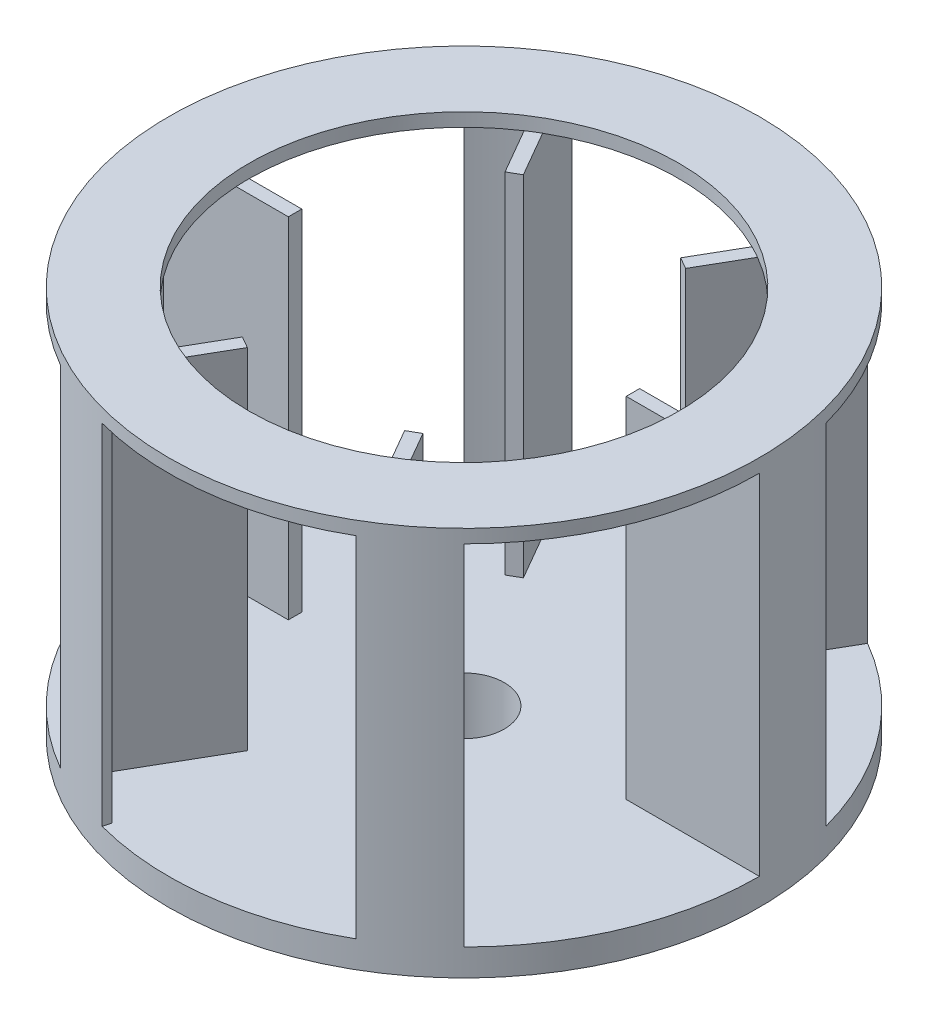
from build123d import *
from build123d.topology import SkipClean

# Parameters (mm, degrees)
SKETCH1_R                      = 137.5
BOSS_EXTRUDE1_DEPTH            = 6.25
BOSS_EXTRUDE2_START            = 162.5
BOSS_EXTRUDE2_DEPTH            = 162.5
BOSS_EXTRUDE3_START            = 12.5
SKETCH3_R                      = 137.5
BOSS_EXTRUDE3_DEPTH            = 12.5
SKETCH4_R                      = 37.5
BOSS_EXTRUDE4_DEPTH            = 62.5
CUT_EXTRUDE1_REACH             = 313.812
SKETCH5_R                      = 18.75
CUT_EXTRUDE1_DIRECTION_2_DEPTH = 312.811742082
SKETCH6_R                      = 100
CUT_EXTRUDE2_DEPTH             = 6.25


with BuildPart() as part:
    # Sketch1 → Boss-Extrude1 (new body)
    with BuildSketch(Plane(origin=(0, 0, 0), x_dir=(1, 0, 0), z_dir=(0, 1, 0))):
        with Locations(Location((0, 0, 0), (0, 0, 270))):
            Circle(SKETCH1_R)
    extrude(amount=BOSS_EXTRUDE1_DEPTH)

    # Sketch2 → Boss-Extrude2 (add)
    with SkipClean():  # the faces are left unmerged after this step: merging them gives an invalid solid
        with BuildSketch(Plane.XZ.offset(BOSS_EXTRUDE2_START)):
            with BuildLine():
                Line((137.5, 0), (75.5, 0))
                Line((75.5, 0), (75.5, -6.25))
                Line((75.5, -6.25), (133.603892159, -6.25))
                ThreePointArc((133.603892159, -6.25), (132.161525003, -20.552221504), (129.192579266, -34.617047282))
                Line((129.192579266, -34.617047282), (132.814801115, -35.587618702))
                ThreePointArc((132.814801115, -35.587618702), (136.323668439, -17.94735143), (137.5, 0))
            make_face()
            with BuildLine():
                Line((68.75, -119.07849302), (37.75, -65.384917986))
                Line((37.75, -65.384917986), (32.337341226, -68.509917986))
                Line((32.337341226, -68.509917986), (61.389287306, -118.829364654))
                ThreePointArc((61.389287306, -118.829364654), (48.282016575, -124.731348808), (34.617047282, -129.192579266))
                Line((34.617047282, -129.192579266), (35.587618702, -132.814801115))
                ThreePointArc((35.587618702, -132.814801115), (52.61897195, -127.03343572), (68.75, -119.07849302))
            make_face()
            with BuildLine():
                Line((-68.75, -119.07849302), (-37.75, -65.384917986))
                Line((-37.75, -65.384917986), (-43.162658774, -62.259917986))
                Line((-43.162658774, -62.259917986), (-72.214604853, -112.579364654))
                ThreePointArc((-72.214604853, -112.579364654), (-83.879508429, -104.179127304), (-94.575531984, -94.575531984))
                Line((-94.575531984, -94.575531984), (-97.227182413, -97.227182413))
                ThreePointArc((-97.227182413, -97.227182413), (-83.704696489, -109.08608429), (-68.75, -119.07849302))
            make_face()
            with BuildLine():
                Line((-137.5, 0), (-75.5, 0))
                Line((-75.5, 0), (-75.5, 6.25))
                Line((-75.5, 6.25), (-133.603892159, 6.25))
                ThreePointArc((-133.603892159, 6.25), (-132.161525003, 20.552221504), (-129.192579266, 34.617047282))
                Line((-129.192579266, 34.617047282), (-132.814801115, 35.587618702))
                ThreePointArc((-132.814801115, 35.587618702), (-136.323668439, 17.94735143), (-137.5, 0))
            make_face()
            with BuildLine():
                Line((-68.75, 119.07849302), (-37.75, 65.384917986))
                Line((-37.75, 65.384917986), (-32.337341226, 68.509917986))
                Line((-32.337341226, 68.509917986), (-61.389287306, 118.829364654))
                ThreePointArc((-61.389287306, 118.829364654), (-48.282016575, 124.731348808), (-34.617047282, 129.192579266))
                Line((-34.617047282, 129.192579266), (-35.587618702, 132.814801115))
                ThreePointArc((-35.587618702, 132.814801115), (-52.61897195, 127.03343572), (-68.75, 119.07849302))
            make_face()
            with BuildLine():
                Line((68.75, 119.07849302), (37.75, 65.384917986))
                Line((37.75, 65.384917986), (43.162658774, 62.259917986))
                Line((43.162658774, 62.259917986), (72.214604853, 112.579364654))
                ThreePointArc((72.214604853, 112.579364654), (83.879508429, 104.179127304), (94.575531984, 94.575531984))
                Line((94.575531984, 94.575531984), (97.227182413, 97.227182413))
                ThreePointArc((97.227182413, 97.227182413), (83.704696489, 109.08608429), (68.75, 119.07849302))
            make_face()
        extrude(amount=-BOSS_EXTRUDE2_DEPTH)

    # Sketch3 → Boss-Extrude3 (add)
    with BuildSketch(Plane.XZ.offset(162.5).offset(BOSS_EXTRUDE3_START)):
        with Locations(Location((0, 0, 0), (0, 0, 270))):
            Circle(SKETCH3_R)
    extrude(amount=-BOSS_EXTRUDE3_DEPTH)

    # Sketch4 → Boss-Extrude4 (add)
    with BuildSketch(Plane.XZ.offset(175)):
        with Locations(Location((0, 0, 0), (0, 0, 270))):
            Circle(SKETCH4_R)
    extrude(amount=BOSS_EXTRUDE4_DEPTH)

    # Sketch5 → Cut-Extrude1 (cut, up to next)
    with BuildSketch(Plane.XZ.offset(237.5), mode=Mode.PRIVATE) as cut_extrude1_sk1:
        with Locations(Location((0, 0, 0), (0, 0, 90))):
            Circle(SKETCH5_R)
    cut_extrude1_tool1 = extrude(cut_extrude1_sk1.sketch, amount=-CUT_EXTRUDE1_REACH, mode=Mode.PRIVATE) & part.part
    add(cut_extrude1_tool1.solids().sort_by_distance((0, -237.5, 0))[0], mode=Mode.SUBTRACT)

    # Sketch5 → Cut-Extrude1 direction 2 (cut)
    with BuildSketch(Plane.XZ.offset(237.5)):
        with Locations(Location((0, 0, 0), (0, 0, 90))):
            Circle(SKETCH5_R)
    extrude(amount=CUT_EXTRUDE1_DIRECTION_2_DEPTH, mode=Mode.SUBTRACT)

    # Sketch6 → Cut-Extrude2 (cut)
    with BuildSketch(Plane(origin=(0, 6.25, 0), x_dir=(1, 0, 0), z_dir=(0, 1, 0))):
        with Locations(Location((0, 0, 0), (0, 0, 270))):
            Circle(SKETCH6_R)
    extrude(amount=-CUT_EXTRUDE2_DEPTH, mode=Mode.SUBTRACT)


solid = part.part
